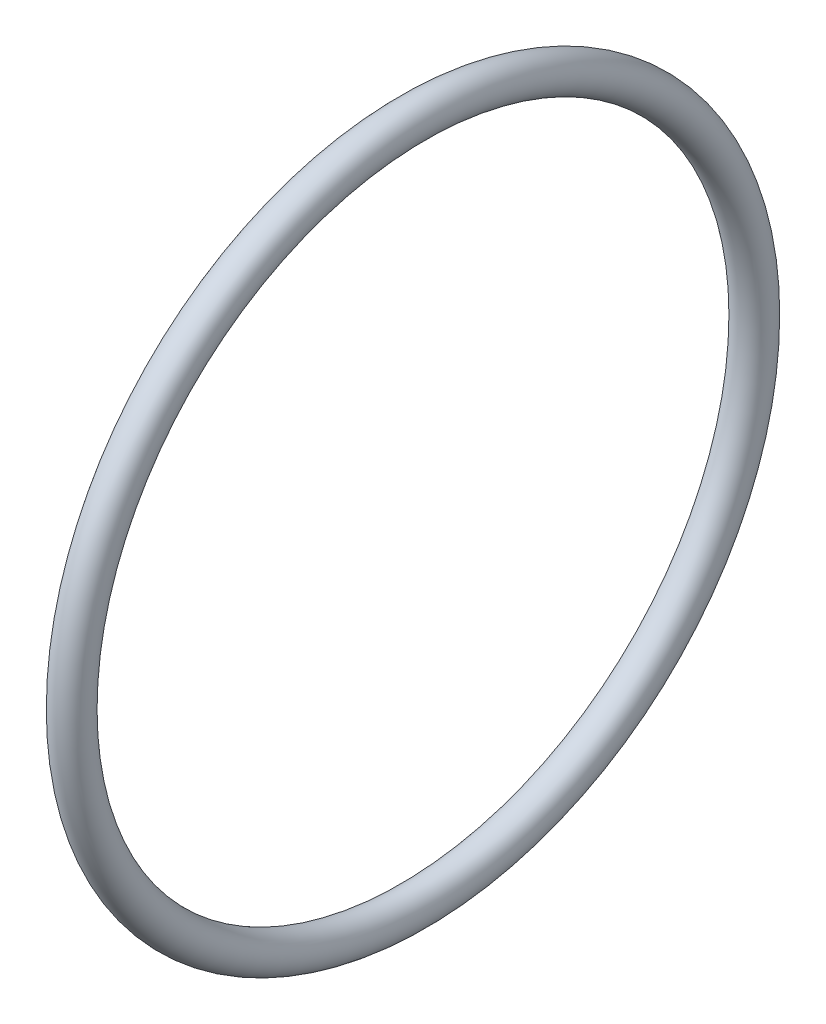
from build123d import *

# Parameters (mm, degrees)
SKETCH1_R = 2.5


with BuildPart() as part:
    # Sketch1 → Revolve1 (revolve)
    with BuildSketch(Plane.XY, mode=Mode.PRIVATE) as revolve1_sk:
        Circle(SKETCH1_R)
    revolve(revolve1_sk.sketch.rotate(Axis((-2.665122588, -47.5, 0), (1, 0, 0)), 90), axis=Axis((-2.665122588, -47.5, 0), (1, 0, 0)))


solid = part.part
